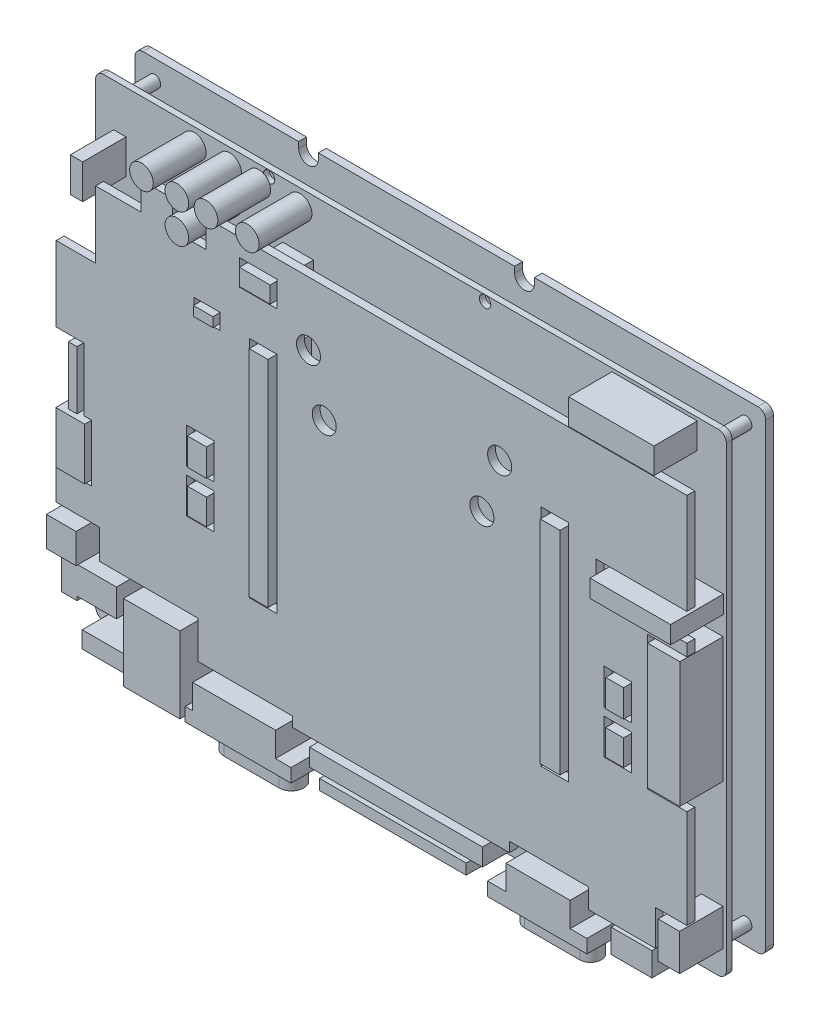
from build123d import *

# Parameters (mm, degrees)
EXTRUDE_1_DEPTH     = 2
FILLET_1_R          = 2
SKETCH_2_R          = 1.5
EXTRUDE_2_DEPTH     = 8.5
EXTRUDE_START       = 1.5
SKETCH_3_R          = 1.45
EXTRUDE_3_DEPTH     = 1.5
SKETCH_4_R          = 1.5
EXTRUDE_4_DEPTH     = 8
SKETCH_5_R          = 3.05
SKETCH_5_W          = 9.5
SKETCH_5_H          = 6.5
SKETCH_5_W_2        = 7
SKETCH_5_H_2        = 57
SKETCH_5_W_3        = 6.5
SKETCH_5_H_3        = 4
SKETCH_5_H_4        = 9
EXTRUDE_5_DEPTH     = 2
SKETCH_6_W          = 43.876960346
SKETCH_6_H          = 4.41276435
SKETCH_6_W_2        = 37.206616977
SKETCH_6_H_2        = 2.674396442
SKETCH_6_W_3        = 4.736080985
SKETCH_6_H_3        = 54.53258962
SKETCH_6_W_4        = 5.021627463
SKETCH_6_H_4        = 53.763864679
SKETCH_6_W_5        = 5.466193463
SKETCH_6_H_5        = 9.292205474
SKETCH_6_W_6        = 8.188870023
SKETCH_6_H_6        = 31.797682115
SKETCH_6_W_7        = 21.621760645
SKETCH_6_H_7        = 6.513429354
SKETCH_6_W_8        = 7.327781674
SKETCH_6_H_8        = 13.134447407
SKETCH_6_W_9        = 2.157348849
SKETCH_6_H_9        = 14.784184763
SKETCH_6_W_10       = 3.128648204
SKETCH_6_H_10       = 8.751711905
SKETCH_6_W_11       = 4.892553138
SKETCH_6_H_11       = 6.523404184
SKETCH_6_H_12       = 6.907133842
SKETCH_6_W_12       = 4.912226665
SKETCH_6_H_13       = 2.419798333
SKETCH_6_W_13       = 4.537138699
SKETCH_6_W_14       = 7.785821687
SKETCH_6_H_14       = 4.224222404
EXTRUDE_6_DEPTH     = 11
SKETCH_7_W          = 7.530225833
SKETCH_7_H          = 7.530225833
SKETCH_7_W_2        = 14.292475605
SKETCH_7_H_2        = 19.324657981
SKETCH_7_W_3        = 21.034804705
SKETCH_7_H_3        = 6.242035543
SKETCH_7_R          = 3
SKETCH_7_W_4        = 20.441910325
SKETCH_7_H_4        = 4.468696675
SKETCH_7_W_5        = 16.286331961
EXTRUDE_7_DEPTH     = 13.4
SKETCH_8_W          = 10
SKETCH_8_H          = 7
SKETCH_8_W_2        = 4
SKETCH_8_H_2        = 9
SKETCH_8_W_3        = 10.325150832
SKETCH_8_H_3        = 6.011747664
SKETCH_8_W_4        = 12.256047803
SKETCH_8_H_4        = 4.242478086
EXTRUDE_8_DEPTH     = 10
SKETCH_9_R          = 3
CUT_EXTRUDE_1_DEPTH = 9.5
EXTRUDE_9_DEPTH     = 6


with BuildPart() as part:
    # 草图1 → 凸台-拉伸1 (new body)
    with BuildSketch(Plane.XY):
        with BuildLine():
            ThreePointArc((46.5, 118.5), (44, 116), (41.5, 118.5))
            Line((41.5, 118.5), (41.5, 120))
            Line((41.5, 120), (0, 120))
            Line((0, 120), (0, 0))
            Line((0, 0), (160, 0))
            Line((160, 0), (160, 120))
            Line((160, 120), (101.3, 120))
            Line((101.3, 120), (101.3, 118.5))
            ThreePointArc((101.3, 118.5), (98.8, 116), (96.3, 118.5))
            Line((96.3, 118.5), (96.3, 120))
            Line((96.3, 120), (46.5, 120))
            Line((46.5, 120), (46.5, 118.5))
        make_face()
    extrude(amount=EXTRUDE_1_DEPTH)

    # 圆角1
    fillet_1_edges = [part.edges().sort_by_distance(p)[0] for p in [
        (160, 120, 1),
        (160, 0, 1),
        (0, 0, 1),
        (0, 120, 1),
    ]]
    fillet(fillet_1_edges, radius=FILLET_1_R)

    # 草图2 → 凸台-拉伸2 (add)
    with BuildSketch(Plane.XY.offset(2)):
        with Locations((5, 115)):
            Circle(SKETCH_2_R)
        with Locations((5, 5)):
            Circle(SKETCH_2_R)
        with Locations((155, 5)):
            Circle(SKETCH_2_R)
        with Locations((155, 115)):
            Circle(SKETCH_2_R)
    extrude(amount=EXTRUDE_2_DEPTH)

    # 草图3 → 凸台-拉伸3 (add)
    with BuildSketch(Plane.XY.offset(10.5).offset(EXTRUDE_START)):
        with BuildLine():
            Line((2, 0), (158, 0))
            ThreePointArc((158, 0), (159.414213562, 0.585786438), (160, 2))
            Line((160, 2), (160, 118))
            ThreePointArc((160, 118), (159.414213562, 119.414213562), (158, 120))
            Line((158, 120), (2, 120))
            ThreePointArc((2, 120), (0.585786438, 119.414213562), (0, 118))
            Line((0, 118), (0, 2))
            ThreePointArc((0, 2), (0.585786438, 0.585786438), (2, 0))
        make_face()
        with Locations((44, 118.5)):
            Circle(SKETCH_3_R, mode=Mode.SUBTRACT)
        with Locations((98.8, 118.5)):
            Circle(SKETCH_3_R, mode=Mode.SUBTRACT)
    extrude(amount=-EXTRUDE_3_DEPTH)

    # 草图4 → 凸台-拉伸4 (add)
    with BuildSketch(Plane.XY.offset(12)):
        with Locations((30.043997064, 79.703414771)):
            Circle(SKETCH_4_R)
        with Locations((25.161734997, 17.105840411)):
            Circle(SKETCH_4_R)
        with Locations((139.371794065, 12.223578344)):
            Circle(SKETCH_4_R)
        with Locations((139.371794065, 104.812191115)):
            Circle(SKETCH_4_R)
    extrude(amount=EXTRUDE_4_DEPTH)

    # 草图5 → 凸台-拉伸5 (add)
    with BuildSketch(Plane.XY.offset(20)):
        Polygon((0, 38), (0, 30), (10.995327104, 30), (10.995327104, 22.5), (35.995327104, 22.5), (35.995327104, 13), (59.995327104, 13), (59.995327104, 10.5), (114.995327104, 10.5), (114.995327104, 13), (134.995327104, 13), (134.995327104, 8), (151.995327104, 8), (151.995327104, 17), (160, 17), (160, 42), (150, 42), (150, 76), (160, 76), (160, 79), (137, 79), (137, 86), (160, 86), (160, 111.5), (38, 111.5), (38, 104.5), (29.5, 104.5), (29.5, 111.5), (21.5, 111.5), (21.5, 104.5), (10, 104.5), (10, 87.5), (0, 87.5), (0, 68.5), (6.995327104, 68.5), (6.995327104, 52.5), (8.995327104, 52.5), (8.995327104, 38), align=None)
        with Locations((112.5, 95.4)):
            Circle(SKETCH_5_R, mode=Mode.SUBTRACT)
        with Locations((68, 82)):
            Circle(SKETCH_5_R, mode=Mode.SUBTRACT)
        with Locations((108, 82)):
            Circle(SKETCH_5_R, mode=Mode.SUBTRACT)
        with Locations((64, 95.4)):
            Circle(SKETCH_5_R, mode=Mode.SUBTRACT)
        with Locations((51.25, 103.75)):
            Rectangle(SKETCH_5_W, SKETCH_5_H, mode=Mode.SUBTRACT)
        with Locations((52.5, 62)):
            Rectangle(SKETCH_5_W_2, SKETCH_5_H_2, mode=Mode.SUBTRACT)
        with Locations((126.5, 62)):
            Rectangle(SKETCH_5_W_2, SKETCH_5_H_2, mode=Mode.SUBTRACT)
        with Locations((38.25, 90.5)):
            Rectangle(SKETCH_5_W_3, SKETCH_5_H_3, mode=Mode.SUBTRACT)
        with Locations((36.5, 59)):
            Rectangle(SKETCH_5_W_2, SKETCH_5_H_4, mode=Mode.SUBTRACT)
        with Locations((36.5, 48)):
            Rectangle(SKETCH_5_W_2, SKETCH_5_H_4, mode=Mode.SUBTRACT)
        with Locations((142.5, 59)):
            Rectangle(SKETCH_5_W_2, SKETCH_5_H_4, mode=Mode.SUBTRACT)
        with Locations((142.5, 48)):
            Rectangle(SKETCH_5_W_2, SKETCH_5_H_4, mode=Mode.SUBTRACT)
    extrude(amount=EXTRUDE_5_DEPTH)

    # 草图6 → 凸台-拉伸6 (add)
    with BuildSketch(Plane.XY.offset(12)):
        with Locations((87.192321161, 7.105396772)):
            Rectangle(SKETCH_6_W, SKETCH_6_H)
        with Locations((86.393513875, 2.387252442)):
            Rectangle(SKETCH_6_W_2, SKETCH_6_H_2)
        with Locations((52.338251329, 61.956435335)):
            Rectangle(SKETCH_6_W_3, SKETCH_6_H_3)
        with Locations((126.306918289, 61.839343664)):
            Rectangle(SKETCH_6_W_4, SKETCH_6_H_4)
        with Locations((156.433811057, 11.145571221)):
            Rectangle(SKETCH_6_W_5, SKETCH_6_H_5)
        with Locations((155.106773449, 59.159935375)):
            Rectangle(SKETCH_6_W_6, SKETCH_6_H_6)
        with Locations((141.817868162, 115.906513881)):
            Rectangle(SKETCH_6_W_7, SKETCH_6_H_7)
        with Locations((4.551867497, 45.191145699)):
            Rectangle(SKETCH_6_W_8, SKETCH_6_H_8)
        with Locations((5.170089371, 60.41949052)):
            Rectangle(SKETCH_6_W_9, SKETCH_6_H_9)
        with Locations((6.147327675, 104.746793739)):
            Rectangle(SKETCH_6_W_10, SKETCH_6_H_10)
        with Locations((36.690386838, 47.916907863)):
            Rectangle(SKETCH_6_W_11, SKETCH_6_H_11)
        with Locations((36.690386838, 58.757270698)):
            Rectangle(SKETCH_6_W_11, SKETCH_6_H_12)
        with Locations((38.285756152, 90.432629311)):
            Rectangle(SKETCH_6_W_12, SKETCH_6_H_13)
        with Locations((142.667322426, 58.757270698)):
            Rectangle(SKETCH_6_W_13, SKETCH_6_H_12)
        with Locations((142.667322426, 47.916907863)):
            Rectangle(SKETCH_6_W_13, SKETCH_6_H_11)
        with Locations((51.380873455, 103.748154849)):
            Rectangle(SKETCH_6_W_14, SKETCH_6_H_14)
    extrude(amount=EXTRUDE_6_DEPTH)

    # 草图7 → 凸台-拉伸7 (add)
    with BuildSketch(Plane.XY.offset(12)):
        with Locations((4.673781059, 25.723847087)):
            Rectangle(SKETCH_7_W, SKETCH_7_H)
        with Locations((27.60515197, 11.125697909)):
            Rectangle(SKETCH_7_W_2, SKETCH_7_H_2)
        with Locations((48.518070901, 8.004680138)):
            Rectangle(SKETCH_7_W_3, SKETCH_7_H_3)
        with Locations((25.026598743, 115.769064638)):
            Circle(SKETCH_7_R)
        with Locations((34.009258147, 115.769064638)):
            Circle(SKETCH_7_R)
        with Locations(Location((41.399951938, 115.769064638, 0), (0, 0, 67.447483295))):
            Circle(SKETCH_7_R)
        with Locations((51.869987313, 115.769064638)):
            Circle(SKETCH_7_R)
        with Locations((34.009258147, 108.210363892)):
            Circle(SKETCH_7_R)
        with Locations((149.035493712, 82.209938502)):
            Rectangle(SKETCH_7_W_4, SKETCH_7_H_4)
        Polygon((133.769480606, 4.883662366), (117.483148645, 4.883662366), (112.800828207, 4.883662366), (112.800828207, 1.463368918), (138.044642745, 1.463368918), (138.044642745, 4.883662366), align=None)
        Polygon((59.035473253, 4.883662366), (38.000668548, 4.883662366), (36.119507152, 4.883662366), (36.119507152, 1.463368918), (62.968810718, 1.463368918), (62.968810718, 4.883662366), align=None)
        with Locations((125.626314626, 8.004680138)):
            Rectangle(SKETCH_7_W_5, SKETCH_7_H_3)
    extrude(amount=EXTRUDE_7_DEPTH)

    # 草图8 → 凸台-拉伸8 (add)
    with BuildSketch(Plane.XY.offset(12)):
        with Locations((10.277084628, 15.5)):
            Rectangle(SKETCH_8_W, SKETCH_8_H)
        with Locations((3.277084628, 15.5)):
            Rectangle(SKETCH_8_W_2, SKETCH_8_H_2)
        with Locations((145.964645287, 4.033092772)):
            Rectangle(SKETCH_8_W_3, SKETCH_8_H_3)
        with Locations((12.708720527, 3.148457983)):
            Rectangle(SKETCH_8_W_4, SKETCH_8_H_4)
    extrude(amount=EXTRUDE_8_DEPTH)

    # 草图9 → 切除-拉伸1 (cut)
    with BuildSketch(Plane.ZY.offset(-1.277084628)):
        with Locations((18.5, 15.5)):
            Circle(SKETCH_9_R)
    extrude(amount=-CUT_EXTRUDE_1_DEPTH, mode=Mode.SUBTRACT)

    # 草图11 → 凸台-拉伸9 (add)
    with BuildSketch(Plane.XZ.offset(-1.463368918)):
        with BuildLine():
            Line((42.544158935, 21.981245079), (56.544158935, 21.981245079))
            ThreePointArc((56.544158935, 21.981245079), (59.654521241, 18.870882773), (56.544158935, 15.760520467))
            Line((56.544158935, 15.760520467), (42.544158935, 15.760520467))
            ThreePointArc((42.544158935, 15.760520467), (39.433796629, 18.870882773), (42.544158935, 21.981245079))
        make_face()
        with BuildLine():
            Line((118.422735476, 21.600714507), (132.422735476, 21.600714507))
            ThreePointArc((132.422735476, 21.600714507), (135.15256721, 18.870882773), (132.422735476, 16.141051038))
            Line((132.422735476, 16.141051038), (118.422735476, 16.141051038))
            ThreePointArc((118.422735476, 16.141051038), (115.692903741, 18.870882773), (118.422735476, 21.600714507))
        make_face()
    extrude(amount=EXTRUDE_9_DEPTH)


solid = part.part
